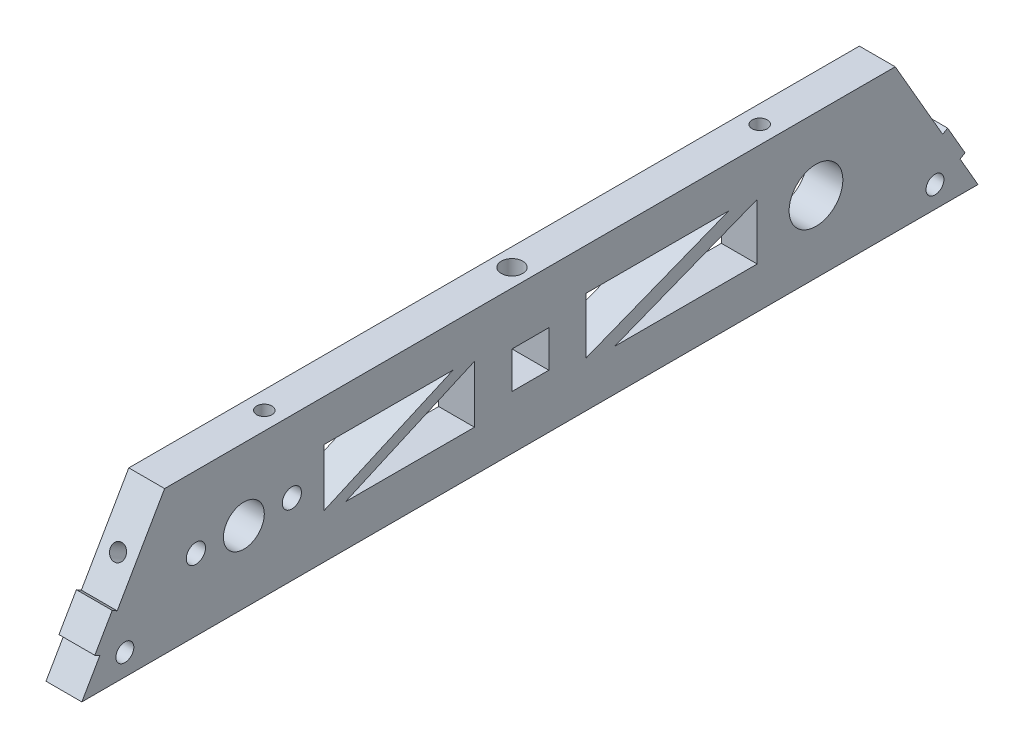
from build123d import *

# Parameters (mm, degrees)
SKETCH1_R                     = 3.6195
SKETCH1_R_2                   = 4.7625
SKETCH1_R_3                   = 1.6999966
SKETCH1_W                     = 6.5278
SKETCH1_H                     = 6.5278
BOSS_EXTRUDE1_DEPTH           = 6.35
TAP_DRILL_FOR_6_32_TAP4_D     = 2.7051
TAP_DRILL_FOR_6_32_TAP4_DEPTH = 10.16
TAP_DRILL_FOR_6_32_TAP4_TIP   = 0.81269403
TAP_DRILL_FOR_6_32_TAP3_D     = 2.7051
TAP_DRILL_FOR_6_32_TAP3_DEPTH = 10.16
TAP_DRILL_FOR_6_32_TAP3_TIP   = 0.81269403
SKETCH11_W                    = 6.35
SKETCH11_H                    = 6.1722
BOSS_EXTRUDE2_DEPTH           = 1.016
SKETCH12_W                    = 6.35
SKETCH12_H                    = 6.1722
BOSS_EXTRUDE3_DEPTH           = 1.016
TAP_DRILL_FOR_6_32_TAP1_D     = 2.7051
TAP_DRILL_FOR_6_32_TAP1_DEPTH = 7.62
TAP_DRILL_FOR_6_32_TAP1_TIP   = 0.81269403
TAP_DRILL_FOR_6_32_TAP2_D     = 2.7051
TAP_DRILL_FOR_6_32_TAP2_DEPTH = 7.62
TAP_DRILL_FOR_6_32_TAP2_TIP   = 0.81269403
F_6_CLEARANCE_HOLE1_D         = 3.7973
F_6_CLEARANCE_HOLE1_DEPTH     = 12.7
F_6_CLEARANCE_HOLE1_TIP       = 1.140824014
SKETCH19_R                    = 1.5875
CUT_EXTRUDE1_DEPTH            = 161.894515133
CUT_EXTRUDE2_DEPTH            = 161.894515133


with BuildPart() as part:
    # Sketch1 → Boss-Extrude1 (new body)
    with BuildSketch(Plane(origin=(0, 0, 0), x_dir=(0, 0, -1), z_dir=(1, 0, 0))):
        Polygon((0, 0), (-14.664696837, 25.4), (-144.085303163, 25.4), (-158.75, 0), align=None)
        with Locations((-130.048, 12.7)):
            Circle(SKETCH1_R, mode=Mode.SUBTRACT)
        with Locations((-28.702, 12.7)):
            Circle(SKETCH1_R_2, mode=Mode.SUBTRACT)
        with Locations((-121.5479916, 12.7)):
            Circle(SKETCH1_R_3, mode=Mode.SUBTRACT)
        with Locations((-138.5480084, 12.7)):
            Circle(SKETCH1_R_3, mode=Mode.SUBTRACT)
        with Locations((-79.2861, 12.7889)):
            Rectangle(SKETCH1_W, SKETCH1_H, mode=Mode.SUBTRACT)
    extrude(amount=BOSS_EXTRUDE1_DEPTH)

    # Tap Drill for #6-32 Tap4
    with Locations(Plane(origin=(0, 25.4, 0), x_dir=(1, 0, 0), z_dir=(0, 1, 0))):
        with Locations((3.175, -123.257303163), (3.175, -35.492696837)):
            Hole(TAP_DRILL_FOR_6_32_TAP4_D / 2, depth=TAP_DRILL_FOR_6_32_TAP4_DEPTH)
            with Locations((0, 0, -(TAP_DRILL_FOR_6_32_TAP4_DEPTH + TAP_DRILL_FOR_6_32_TAP4_TIP / 2))):  # 118° drill point
                Cone(0, TAP_DRILL_FOR_6_32_TAP4_D / 2, TAP_DRILL_FOR_6_32_TAP4_TIP, mode=Mode.SUBTRACT)

    # Tap Drill for #6-32 Tap3
    with Locations(Plane(origin=(0, 0, 0), x_dir=(-1, 0, 0), z_dir=(0, -1, 0))):
        with Locations((-3.175, -116.84), (-3.175, -35.56)):
            Hole(TAP_DRILL_FOR_6_32_TAP3_D / 2, depth=TAP_DRILL_FOR_6_32_TAP3_DEPTH)
            with Locations((0, 0, -(TAP_DRILL_FOR_6_32_TAP3_DEPTH + TAP_DRILL_FOR_6_32_TAP3_TIP / 2))):  # 118° drill point
                Cone(0, TAP_DRILL_FOR_6_32_TAP3_D / 2, TAP_DRILL_FOR_6_32_TAP3_TIP, mode=Mode.SUBTRACT)

    # Sketch11 → Boss-Extrude2 (add)
    with BuildSketch(Plane(origin=(0, 68.740766425, 119.0625), x_dir=(1, 0, 0), z_dir=(0, 0.5000000000000038, 0.8660254037844366))):
        with Locations((3.175, -69.9389)):
            Rectangle(SKETCH11_W, SKETCH11_H)
    extrude(amount=BOSS_EXTRUDE2_DEPTH)

    # Sketch12 → Boss-Extrude3 (add)
    with BuildSketch(Plane(origin=(0, 0, 0), x_dir=(-1, 0, 0), z_dir=(0, 0.499999999999998, -0.8660254037844397))):
        with Locations((-3.175, 9.4361)):
            Rectangle(SKETCH12_W, SKETCH12_H)
    extrude(amount=BOSS_EXTRUDE3_DEPTH)

    # Tap Drill for #6-32 Tap1
    with Locations(Plane(origin=(0, 68.740766425, 119.0625), x_dir=(1, 0, 0), z_dir=(0, 0.5000000000000038, 0.8660254037844366))):
        with Locations((3.175, -60.205606325)):
            Hole(TAP_DRILL_FOR_6_32_TAP1_D / 2, depth=TAP_DRILL_FOR_6_32_TAP1_DEPTH)
            with Locations((0, 0, -(TAP_DRILL_FOR_6_32_TAP1_DEPTH + TAP_DRILL_FOR_6_32_TAP1_TIP / 2))):  # 118° drill point
                Cone(0, TAP_DRILL_FOR_6_32_TAP1_D / 2, TAP_DRILL_FOR_6_32_TAP1_TIP, mode=Mode.SUBTRACT)

    # Tap Drill for #6-32 Tap2
    with Locations(Plane(origin=(0, 0, 0), x_dir=(-1, 0, 0), z_dir=(0, 0.49999999999999806, -0.8660254037844398))):
        with Locations((-3.175, 19.169393675)):
            Hole(TAP_DRILL_FOR_6_32_TAP2_D / 2, depth=TAP_DRILL_FOR_6_32_TAP2_DEPTH)
            with Locations((0, 0, -(TAP_DRILL_FOR_6_32_TAP2_DEPTH + TAP_DRILL_FOR_6_32_TAP2_TIP / 2))):  # 118° drill point
                Cone(0, TAP_DRILL_FOR_6_32_TAP2_D / 2, TAP_DRILL_FOR_6_32_TAP2_TIP, mode=Mode.SUBTRACT)

    # #6 Clearance Hole1
    with Locations(Plane(origin=(0, 25.4, 0), x_dir=(1, 0, 0), z_dir=(0, 1, 0))):
        with Locations((3.175, -79.375)):
            Hole(F_6_CLEARANCE_HOLE1_D / 2, depth=F_6_CLEARANCE_HOLE1_DEPTH)
            with Locations((0, 0, -(F_6_CLEARANCE_HOLE1_DEPTH + F_6_CLEARANCE_HOLE1_TIP / 2))):  # 118° drill point
                Cone(0, F_6_CLEARANCE_HOLE1_D / 2, F_6_CLEARANCE_HOLE1_TIP, mode=Mode.SUBTRACT)

    # Sketch19 → Cut-Extrude1 (cut, through all)
    with BuildSketch(Plane.ZY):
        with Locations((151.13, 3.81)):
            Circle(SKETCH19_R)
        with Locations((7.62, 3.81)):
            Circle(SKETCH19_R)
    extrude(amount=-CUT_EXTRUDE1_DEPTH, mode=Mode.SUBTRACT)

    # Sketch20 → Cut-Extrude2 (cut, through all)
    with BuildSketch(Plane.ZY):
        Polygon((64.373574984, 7.366), (39.116, 17.286492924), (39.116, 7.366), align=None)
        Polygon((69.4182, 18.034), (44.160625016, 18.034), (69.4182, 8.113507076), align=None)
        Polygon((112.039277302, 7.366), (89.195364135, 17.488514329), (89.195364135, 7.366), align=None)
        Polygon((115.824, 18.034), (92.980086833, 18.034), (115.824, 7.911485671), align=None)
    extrude(amount=-CUT_EXTRUDE2_DEPTH, mode=Mode.SUBTRACT)


solid = part.part
